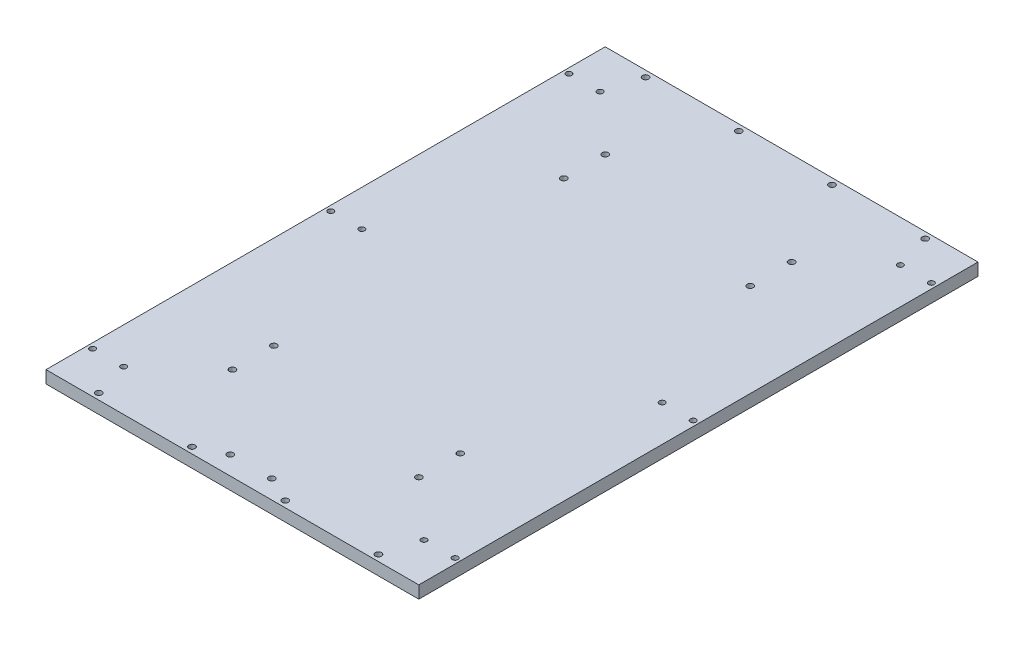
from build123d import *

# Parameters (mm, degrees)
SKETCH1_W               = 360
SKETCH1_H               = 540
BOSS_EXTRUDE1_DEPTH     = 12
CUT_EXTRUDE1_REACH      = 326.721
SKETCH2_R               = 3
CUT_EXTRUDE2_REACH      = 326.721
SKETCH3_R               = 3
LPATTERN1_COUNT         = 4
LPATTERN1_PITCH         = 90
MIRROR1_COPY_1_REACH    = 326.721
MIRROR1_COPY_1_SKETCH_R = 3
MIRROR1_COPY_2_REACH    = 326.721
MIRROR1_COPY_2_SKETCH_R = 3
MIRROR1_COPY_3_REACH    = 326.721
MIRROR1_COPY_3_SKETCH_R = 3
CUT_EXTRUDE3_REACH      = 326.721
SKETCH4_R               = 2.75
LPATTERN2_COUNT         = 3
LPATTERN2_PITCH         = 230
MIRROR2_COPY_1_REACH    = 326.721
MIRROR2_COPY_1_SKETCH_R = 2.75
MIRROR2_COPY_2_REACH    = 326.721
MIRROR2_COPY_2_SKETCH_R = 2.75
CUT_EXTRUDE4_REACH      = 326.721
SKETCH6_R               = 3
MIRROR4_COPY_1_REACH    = 326.721
MIRROR4_COPY_1_SKETCH_R = 3


with BuildPart() as part:
    # Sketch1 → Boss-Extrude1 (new body)
    with BuildSketch(Plane(origin=(0, 0, 0), x_dir=(1, 0, 0), z_dir=(0, 1, 0))):
        Rectangle(SKETCH1_W, SKETCH1_H)
    extrude(amount=BOSS_EXTRUDE1_DEPTH)

    # Sketch2 → Cut-Extrude1 (cut, up to next)
    with BuildSketch(Plane.XZ, mode=Mode.PRIVATE) as cut_extrude1_sk1:
        with Locations(Location((-20, 252, 0), (0, 0, 270))):
            Circle(SKETCH2_R)
    cut_extrude1_tool1 = extrude(cut_extrude1_sk1.sketch, amount=-CUT_EXTRUDE1_REACH, mode=Mode.PRIVATE) & part.part
    # Sketch2 → Cut-Extrude1 (cut, up to next)
    with BuildSketch(Plane.XZ, mode=Mode.PRIVATE) as cut_extrude1_sk2:
        with Locations(Location((20, 252, 0), (0, 0, 270))):
            Circle(SKETCH2_R)
    cut_extrude1_tool2 = extrude(cut_extrude1_sk2.sketch, amount=-CUT_EXTRUDE1_REACH, mode=Mode.PRIVATE) & part.part
    add(cut_extrude1_tool1.solids().sort_by_distance((-20, 0, 252))[0], mode=Mode.SUBTRACT)
    add(cut_extrude1_tool2.solids().sort_by_distance((20, 0, 252))[0], mode=Mode.SUBTRACT)

    # Sketch3 → Cut-Extrude2 (cut, up to next)
    with BuildSketch(Plane.XZ, mode=Mode.PRIVATE) as cut_extrude2_sk1:
        with Locations(Location((135, 264, 0), (0, 0, 270))):
            Circle(SKETCH3_R)
    cut_extrude2_tool1 = extrude(cut_extrude2_sk1.sketch, amount=-CUT_EXTRUDE2_REACH, mode=Mode.PRIVATE) & part.part
    cut_extrude2 = cut_extrude2_tool1.solids().sort_by_distance((135, 0, 264))[0]
    add(cut_extrude2, mode=Mode.SUBTRACT)

    # LPattern1: Cut-Extrude2 ×4
    with Locations(*[(-i * LPATTERN1_PITCH, 0, 0) for i in range(1, LPATTERN1_COUNT)]):
        add(cut_extrude2, mode=Mode.SUBTRACT)

    # Mirror1: Cut-Extrude2 across plane
    add(cut_extrude2.mirror(Plane.XY), mode=Mode.SUBTRACT)

    # Mirror1 copy 1 sketch → Mirror1 copy 1 (cut, up to next)
    with BuildSketch(Plane(origin=(-90, 0, 0), x_dir=(1, 0, 0), z_dir=(0, -1, 0)), mode=Mode.PRIVATE) as mirror1_copy_1_sk1:
        with Locations((135, -264)):
            Circle(MIRROR1_COPY_1_SKETCH_R)
    mirror1_copy_1_tool1 = extrude(mirror1_copy_1_sk1.sketch, amount=-MIRROR1_COPY_1_REACH, mode=Mode.PRIVATE) & part.part
    add(mirror1_copy_1_tool1.solids().sort_by_distance((45, 0, -264))[0], mode=Mode.SUBTRACT)

    # Mirror1 copy 2 sketch → Mirror1 copy 2 (cut, up to next)
    with BuildSketch(Plane(origin=(-180, 0, 0), x_dir=(1, 0, 0), z_dir=(0, -1, 0)), mode=Mode.PRIVATE) as mirror1_copy_2_sk1:
        with Locations((135, -264)):
            Circle(MIRROR1_COPY_2_SKETCH_R)
    mirror1_copy_2_tool1 = extrude(mirror1_copy_2_sk1.sketch, amount=-MIRROR1_COPY_2_REACH, mode=Mode.PRIVATE) & part.part
    add(mirror1_copy_2_tool1.solids().sort_by_distance((-45, 0, -264))[0], mode=Mode.SUBTRACT)

    # Mirror1 copy 3 sketch → Mirror1 copy 3 (cut, up to next)
    with BuildSketch(Plane(origin=(-270, 0, 0), x_dir=(1, 0, 0), z_dir=(0, -1, 0)), mode=Mode.PRIVATE) as mirror1_copy_3_sk1:
        with Locations((135, -264)):
            Circle(MIRROR1_COPY_3_SKETCH_R)
    mirror1_copy_3_tool1 = extrude(mirror1_copy_3_sk1.sketch, amount=-MIRROR1_COPY_3_REACH, mode=Mode.PRIVATE) & part.part
    add(mirror1_copy_3_tool1.solids().sort_by_distance((-135, 0, -264))[0], mode=Mode.SUBTRACT)

    # Sketch4 → Cut-Extrude3 (cut, up to next)
    with BuildSketch(Plane(origin=(0, 12, 0), x_dir=(1, 0, 0), z_dir=(0, 1, 0)), mode=Mode.PRIVATE) as cut_extrude3_sk1:
        with Locations(Location((-175, 230, 0), (0, 0, 270))):
            Circle(SKETCH4_R)
    cut_extrude3_tool1 = extrude(cut_extrude3_sk1.sketch, amount=-CUT_EXTRUDE3_REACH, mode=Mode.PRIVATE) & part.part
    # Sketch4 → Cut-Extrude3 (cut, up to next)
    with BuildSketch(Plane(origin=(0, 12, 0), x_dir=(1, 0, 0), z_dir=(0, 1, 0)), mode=Mode.PRIVATE) as cut_extrude3_sk2:
        with Locations(Location((-145, 230, 0), (0, 0, 270))):
            Circle(SKETCH4_R)
    cut_extrude3_tool2 = extrude(cut_extrude3_sk2.sketch, amount=-CUT_EXTRUDE3_REACH, mode=Mode.PRIVATE) & part.part
    cut_extrude3_1 = cut_extrude3_tool1.solids().sort_by_distance((-175, 12, -230))[0]
    add(cut_extrude3_1, mode=Mode.SUBTRACT)
    cut_extrude3_2 = cut_extrude3_tool2.solids().sort_by_distance((-145, 12, -230))[0]
    add(cut_extrude3_2, mode=Mode.SUBTRACT)
    cut_extrude3 = cut_extrude3_1 + cut_extrude3_2  # Cut-Extrude3 as one shape, for the pattern or mirror that repeats it

    # LPattern2: Cut-Extrude3 ×3
    with Locations(*[(0, 0, i * LPATTERN2_PITCH) for i in range(1, LPATTERN2_COUNT)]):
        add(cut_extrude3, mode=Mode.SUBTRACT)

    # Mirror2: Cut-Extrude3 across plane
    add(cut_extrude3.mirror(Plane(origin=(0, 0, 0), x_dir=(0, 0, 1), z_dir=(1, 0, 0))), mode=Mode.SUBTRACT)

    # Mirror2 copy 1 sketch → Mirror2 copy 1 (cut, up to next)
    with BuildSketch(Plane(origin=(0, 12, 230), x_dir=(-1, 0, 0), z_dir=(0, 1, 0)), mode=Mode.PRIVATE) as mirror2_copy_1_sk1:
        with Locations((-175, -230)):
            Circle(MIRROR2_COPY_1_SKETCH_R)
    mirror2_copy_1_tool1 = extrude(mirror2_copy_1_sk1.sketch, amount=-MIRROR2_COPY_1_REACH, mode=Mode.PRIVATE) & part.part
    # Mirror2 copy 1 sketch → Mirror2 copy 1 (cut, up to next)
    with BuildSketch(Plane(origin=(0, 12, 230), x_dir=(-1, 0, 0), z_dir=(0, 1, 0)), mode=Mode.PRIVATE) as mirror2_copy_1_sk2:
        with Locations((-145, -230)):
            Circle(MIRROR2_COPY_1_SKETCH_R)
    mirror2_copy_1_tool2 = extrude(mirror2_copy_1_sk2.sketch, amount=-MIRROR2_COPY_1_REACH, mode=Mode.PRIVATE) & part.part
    add(mirror2_copy_1_tool1.solids().sort_by_distance((175, 12, 0))[0], mode=Mode.SUBTRACT)
    add(mirror2_copy_1_tool2.solids().sort_by_distance((145, 12, 0))[0], mode=Mode.SUBTRACT)

    # Mirror2 copy 2 sketch → Mirror2 copy 2 (cut, up to next)
    with BuildSketch(Plane(origin=(0, 12, 460), x_dir=(-1, 0, 0), z_dir=(0, 1, 0)), mode=Mode.PRIVATE) as mirror2_copy_2_sk1:
        with Locations((-175, -230)):
            Circle(MIRROR2_COPY_2_SKETCH_R)
    mirror2_copy_2_tool1 = extrude(mirror2_copy_2_sk1.sketch, amount=-MIRROR2_COPY_2_REACH, mode=Mode.PRIVATE) & part.part
    # Mirror2 copy 2 sketch → Mirror2 copy 2 (cut, up to next)
    with BuildSketch(Plane(origin=(0, 12, 460), x_dir=(-1, 0, 0), z_dir=(0, 1, 0)), mode=Mode.PRIVATE) as mirror2_copy_2_sk2:
        with Locations((-145, -230)):
            Circle(MIRROR2_COPY_2_SKETCH_R)
    mirror2_copy_2_tool2 = extrude(mirror2_copy_2_sk2.sketch, amount=-MIRROR2_COPY_2_REACH, mode=Mode.PRIVATE) & part.part
    add(mirror2_copy_2_tool1.solids().sort_by_distance((175, 12, 230))[0], mode=Mode.SUBTRACT)
    add(mirror2_copy_2_tool2.solids().sort_by_distance((145, 12, 230))[0], mode=Mode.SUBTRACT)

    # Sketch6 → Cut-Extrude4 (cut, up to next)
    with BuildSketch(Plane(origin=(0, 12, 0), x_dir=(1, 0, 0), z_dir=(0, 1, 0)), mode=Mode.PRIVATE) as cut_extrude4_sk1:
        with Locations(Location((-90, 180, 0), (0, 0, 270))):
            Circle(SKETCH6_R)
    cut_extrude4_tool1 = extrude(cut_extrude4_sk1.sketch, amount=-CUT_EXTRUDE4_REACH, mode=Mode.PRIVATE) & part.part
    # Sketch6 → Cut-Extrude4 (cut, up to next)
    with BuildSketch(Plane(origin=(0, 12, 0), x_dir=(1, 0, 0), z_dir=(0, 1, 0)), mode=Mode.PRIVATE) as cut_extrude4_sk2:
        with Locations(Location((-90, 140, 0), (0, 0, 270))):
            Circle(SKETCH6_R)
    cut_extrude4_tool2 = extrude(cut_extrude4_sk2.sketch, amount=-CUT_EXTRUDE4_REACH, mode=Mode.PRIVATE) & part.part
    cut_extrude4_1 = cut_extrude4_tool1.solids().sort_by_distance((-90, 12, -180))[0]
    add(cut_extrude4_1, mode=Mode.SUBTRACT)
    cut_extrude4_2 = cut_extrude4_tool2.solids().sort_by_distance((-90, 12, -140))[0]
    add(cut_extrude4_2, mode=Mode.SUBTRACT)
    cut_extrude4 = cut_extrude4_1 + cut_extrude4_2  # Cut-Extrude4 as one shape, for the pattern or mirror that repeats it

    # Mirror3: Cut-Extrude4 across plane
    add(cut_extrude4.mirror(Plane.XY), mode=Mode.SUBTRACT)

    # Mirror4: Cut-Extrude4 across plane
    add(cut_extrude4.mirror(Plane(origin=(0, 0, 0), x_dir=(0, 0, 1), z_dir=(1, 0, 0))), mode=Mode.SUBTRACT)

    # Mirror4 copy 1 sketch → Mirror4 copy 1 (cut, up to next)
    with BuildSketch(Plane(origin=(0, 12, 0), x_dir=(-1, 0, 0), z_dir=(0, 1, 0)), mode=Mode.PRIVATE) as mirror4_copy_1_sk1:
        with Locations(Location((-90, 180, 0), (0, 0, 270))):
            Circle(MIRROR4_COPY_1_SKETCH_R)
    mirror4_copy_1_tool1 = extrude(mirror4_copy_1_sk1.sketch, amount=-MIRROR4_COPY_1_REACH, mode=Mode.PRIVATE) & part.part
    # Mirror4 copy 1 sketch → Mirror4 copy 1 (cut, up to next)
    with BuildSketch(Plane(origin=(0, 12, 0), x_dir=(-1, 0, 0), z_dir=(0, 1, 0)), mode=Mode.PRIVATE) as mirror4_copy_1_sk2:
        with Locations(Location((-90, 140, 0), (0, 0, 270))):
            Circle(MIRROR4_COPY_1_SKETCH_R)
    mirror4_copy_1_tool2 = extrude(mirror4_copy_1_sk2.sketch, amount=-MIRROR4_COPY_1_REACH, mode=Mode.PRIVATE) & part.part
    add(mirror4_copy_1_tool1.solids().sort_by_distance((90, 12, 180))[0], mode=Mode.SUBTRACT)
    add(mirror4_copy_1_tool2.solids().sort_by_distance((90, 12, 140))[0], mode=Mode.SUBTRACT)


solid = part.part
